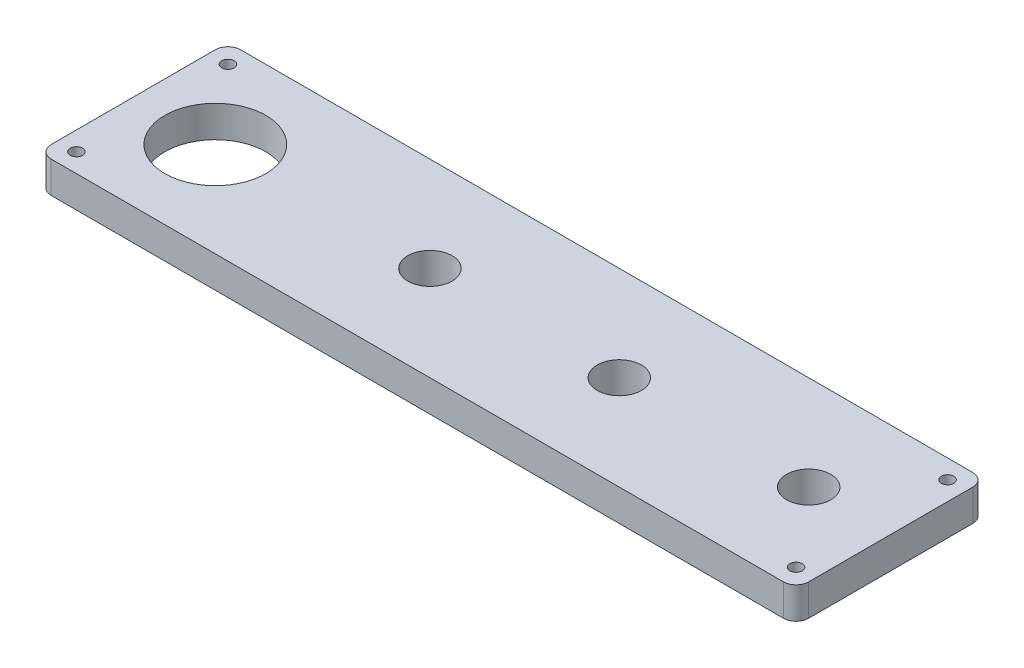
from build123d import *

# Parameters (mm, degrees)
SKETCH1_R             = 4.445
SKETCH1_R_2           = 10.16
BOSS_EXTRUDE1_DEPTH   = 6.35
M3X0_5_TAPPED_HOLE1_D = 2.5


with BuildPart() as part:
    # Sketch1 → Boss-Extrude1 (new body)
    with BuildSketch(Plane.XZ):
        with BuildLine():
            Line((-35.56, -19.05), (111.76, -19.05))
            ThreePointArc((111.76, -19.05), (113.556051224, -18.306051224), (114.3, -16.51))
            Line((114.3, -16.51), (114.3, 16.51))
            ThreePointArc((114.3, 16.51), (113.556051224, 18.306051224), (111.76, 19.05))
            Line((111.76, 19.05), (-35.56, 19.05))
            ThreePointArc((-35.56, 19.05), (-37.356051224, 18.306051224), (-38.1, 16.51))
            Line((-38.1, 16.51), (-38.1, -16.51))
            ThreePointArc((-38.1, -16.51), (-37.356051224, -18.306051224), (-35.56, -19.05))
        make_face()
        with Locations(Location((59.69, 0, 0), (0, 0, 270))):
            Circle(SKETCH1_R, mode=Mode.SUBTRACT)
        with Locations(Location((97.79, 0, 0), (0, 0, 270))):
            Circle(SKETCH1_R, mode=Mode.SUBTRACT)
        with Locations(Location((21.59, 0, 0), (0, 0, 90))):
            Circle(SKETCH1_R, mode=Mode.SUBTRACT)
        with Locations(Location((-21.59, 0, 0), (0, 0, 90))):
            Circle(SKETCH1_R_2, mode=Mode.SUBTRACT)
    extrude(amount=-BOSS_EXTRUDE1_DEPTH)

    # M3x0.5 Tapped Hole1 (through all)
    with Locations(Plane(origin=(0, 6.35, 0), x_dir=(1, 0, 0), z_dir=(0, 1, 0))):
        with Locations((-34.29, 15.24), (110.49, 15.24), (110.49, -15.24), (-34.29, -15.24)):
            Hole(M3X0_5_TAPPED_HOLE1_D / 2)


solid = part.part
